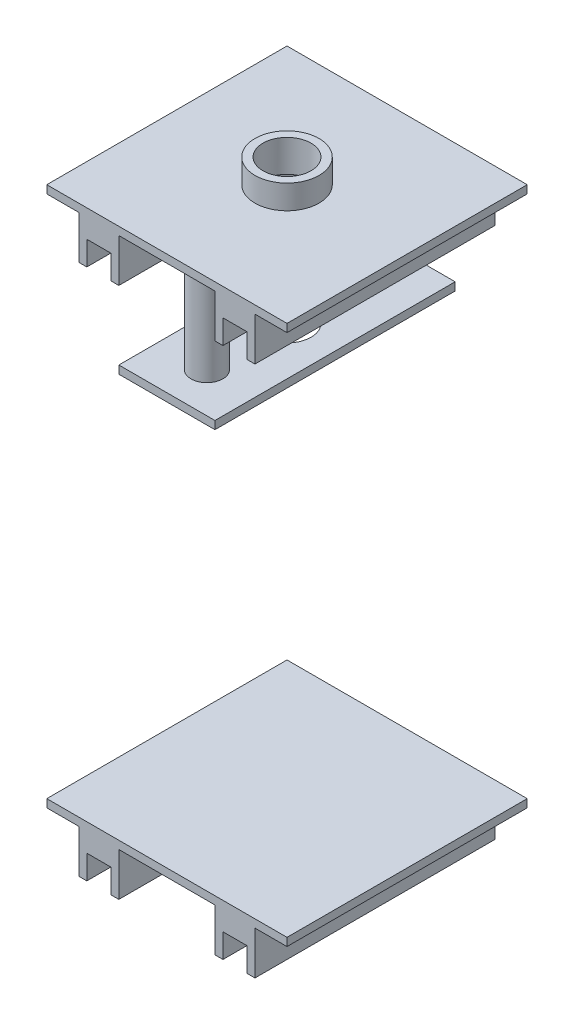
from build123d import *

# Parameters (mm, degrees)
SKETCH_1_W          = 150
SKETCH_1_H          = 150
EXTRUDE_1_DEPTH     = 5
SKETCH_2_W          = 25
SKETCH_2_H          = 150
EXTRUDE_2_DEPTH     = 27
SKETCH_3_W          = 15
SKETCH_3_H          = 150
CUT_EXTRUDE_1_DEPTH = 15
SKETCH_5_W          = 150
SKETCH_5_H          = 5
EXTRUDE_3_DEPTH     = 150
SKETCH_6_W          = 25
SKETCH_6_H          = 150
EXTRUDE_4_DEPTH     = 27
SKETCH_7_W          = 15
SKETCH_7_H          = 150
CUT_EXTRUDE_3_DEPTH = 15
SKETCH_8_R          = 20
EXTRUDE_5_DEPTH     = 15
SKETCH_9_R          = 10
EXTRUDE_6_DEPTH     = 70
EXTRUDE_7_DEPTH     = 5
SKETCH_12_R         = 15
CUT_EXTRUDE_4_DEPTH = 95


with BuildPart() as part:
    # 草图1 → 凸台-拉伸1 (new body)
    with BuildSketch(Plane(origin=(0, 0, 0), x_dir=(1, 0, 0), z_dir=(0, 1, 0))):
        with Locations((75, 75)):
            Rectangle(SKETCH_1_W, SKETCH_1_H)
    extrude(amount=EXTRUDE_1_DEPTH)

    # 草图2 → 凸台-拉伸2 (add)
    with BuildSketch(Plane(origin=(0, 0, 0), x_dir=(-1, 0, 0), z_dir=(0, -1, 0))):
        with Locations((-32.5, 75)):
            Rectangle(SKETCH_2_W, SKETCH_2_H)
        with Locations((-117.5, 75)):
            Rectangle(SKETCH_2_W, SKETCH_2_H)
    extrude(amount=EXTRUDE_2_DEPTH)

    # 草图3 → 切除-拉伸1 (cut)
    with BuildSketch(Plane.XZ.offset(27)):
        with Locations((32.5, -75)):
            Rectangle(SKETCH_3_W, SKETCH_3_H)
        with Locations((117.5, -75)):
            Rectangle(SKETCH_3_W, SKETCH_3_H)
    extrude(amount=-CUT_EXTRUDE_1_DEPTH, mode=Mode.SUBTRACT)


with BuildPart() as body_2:
    # 草图5 → 凸台-拉伸3 (new body)
    with BuildSketch(Plane(origin=(150, 0, 0), x_dir=(0, 0, -1), z_dir=(1, 0, 0))):
        with Locations((75, 334.5)):
            Rectangle(SKETCH_5_W, SKETCH_5_H)
    extrude(amount=-EXTRUDE_3_DEPTH)

    # 草图6 → 凸台-拉伸4 (add)
    with BuildSketch(Plane.XZ.offset(-332)):
        with Locations((117.5, -75)):
            Rectangle(SKETCH_6_W, SKETCH_6_H)
        with Locations((32.5, -75)):
            Rectangle(SKETCH_6_W, SKETCH_6_H)
    extrude(amount=EXTRUDE_4_DEPTH)

    # 草图7 → 切除-拉伸3 (cut)
    with BuildSketch(Plane(origin=(0, 305, 0), x_dir=(-1, 0, 0), z_dir=(0, -1, 0))):
        with Locations((-117.5, 75)):
            Rectangle(SKETCH_7_W, SKETCH_7_H)
        with Locations((-32.5, 75)):
            Rectangle(SKETCH_7_W, SKETCH_7_H)
    extrude(amount=-CUT_EXTRUDE_3_DEPTH, mode=Mode.SUBTRACT)

    # 草图8 → 凸台-拉伸5 (add)
    with BuildSketch(Plane(origin=(0, 337, 0), x_dir=(1, 0, 0), z_dir=(0, 1, 0))):
        with Locations(Location((75, 75, 0), (0, 0, 270))):
            Circle(SKETCH_8_R)
    extrude(amount=EXTRUDE_5_DEPTH)

    # 草图9 → 凸台-拉伸6 (add)
    with BuildSketch(Plane(origin=(0, 332, 0), x_dir=(-1, 0, 0), z_dir=(0, -1, 0))):
        with Locations(Location((-75, 25, 0), (0, 0, 90))):
            Circle(SKETCH_9_R)
        with Locations(Location((-75, 125, 0), (0, 0, 90))):
            Circle(SKETCH_9_R)
    extrude(amount=EXTRUDE_6_DEPTH)

    # 草图10 → 凸台-拉伸7 (add)
    with BuildSketch(Plane.XZ.offset(-262)):
        Polygon((75, 0), (105, 0), (105, -125), (105, -150), (45, -150), (45, -125), (45, 0), align=None)
    extrude(amount=EXTRUDE_7_DEPTH)

    # 草图12 → 切除-拉伸4 (cut)
    with BuildSketch(Plane(origin=(0, 352, 0), x_dir=(1, 0, 0), z_dir=(0, 1, 0))):
        with Locations(Location((75, 75, 0), (0, 0, 270))):
            Circle(SKETCH_12_R)
    extrude(amount=-CUT_EXTRUDE_4_DEPTH, mode=Mode.SUBTRACT)


solid = Compound([part.part, body_2.part])
